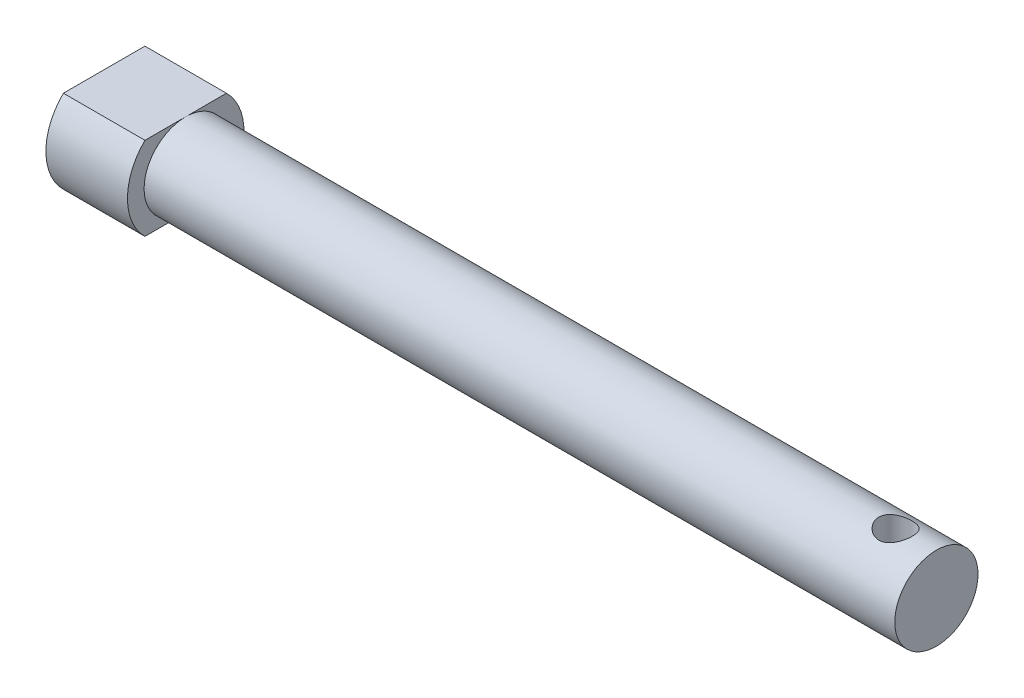
from build123d import *

# Parameters (mm, degrees)
SKETCH2_R               = 2.5
BOSS_EXTRUDE1_DEPTH     = 25
BOSS_EXTRUDE4_START     = -4.9
BOSS_EXTRUDE4_DEPTH     = 4.9
CUT_EXTRUDE2_DEPTH      = 26.734218465
CUT_EXTRUDE2_DEPTH_BACK = 26.734218465
SKETCH5_R               = 1


with BuildPart() as part:
    # Sketch2 → Boss-Extrude1 (new, symmetric)
    with BuildSketch(Plane(origin=(0, 0, 0), x_dir=(0, 0, -1), z_dir=(1, 0, 0))):
        Circle(SKETCH2_R)
    extrude(amount=BOSS_EXTRUDE1_DEPTH, both=True)

    # Sketch3 → Boss-Extrude4 (add)
    with BuildSketch(Plane.ZY.offset(25).offset(BOSS_EXTRUDE4_START)):
        with BuildLine():
            Line((0, 2.5), (-2.449489743, 2.5))
            ThreePointArc((-2.449489743, 2.5), (-3.5, 0), (-2.449489743, -2.5))
            Line((-2.449489743, -2.5), (0, -2.5))
            ThreePointArc((0, -2.5), (-2.5, 0), (0, 2.5))
        make_face()
        with BuildLine():
            Line((2.449489743, 2.5), (0, 2.5))
            ThreePointArc((0, 2.5), (1.767766953, 1.767766953), (2.5, 0))
            ThreePointArc((2.5, 0), (1.767766953, -1.767766953), (0, -2.5))
            Line((0, -2.5), (2.449489743, -2.5))
            ThreePointArc((2.449489743, -2.5), (3.226702194, -1.355873501), (3.5, 0))
            ThreePointArc((3.5, 0), (3.226702194, 1.355873501), (2.449489743, 2.5))
        make_face()
    extrude(amount=BOSS_EXTRUDE4_DEPTH)

    # Sketch5 → Cut-Extrude2 (cut, two sides: drawn at the far end of the back side and taken through both)
    with BuildSketch(Plane(origin=(0, 2.5, 0), x_dir=(1, 0, 0), z_dir=(0, 1, 0)).offset(-CUT_EXTRUDE2_DEPTH_BACK)):
        with Locations(Location((22.55, 0, 0), (0, 0, 180.000000001))):
            Circle(SKETCH5_R)
    extrude(amount=CUT_EXTRUDE2_DEPTH + CUT_EXTRUDE2_DEPTH_BACK, mode=Mode.SUBTRACT)


solid = part.part
